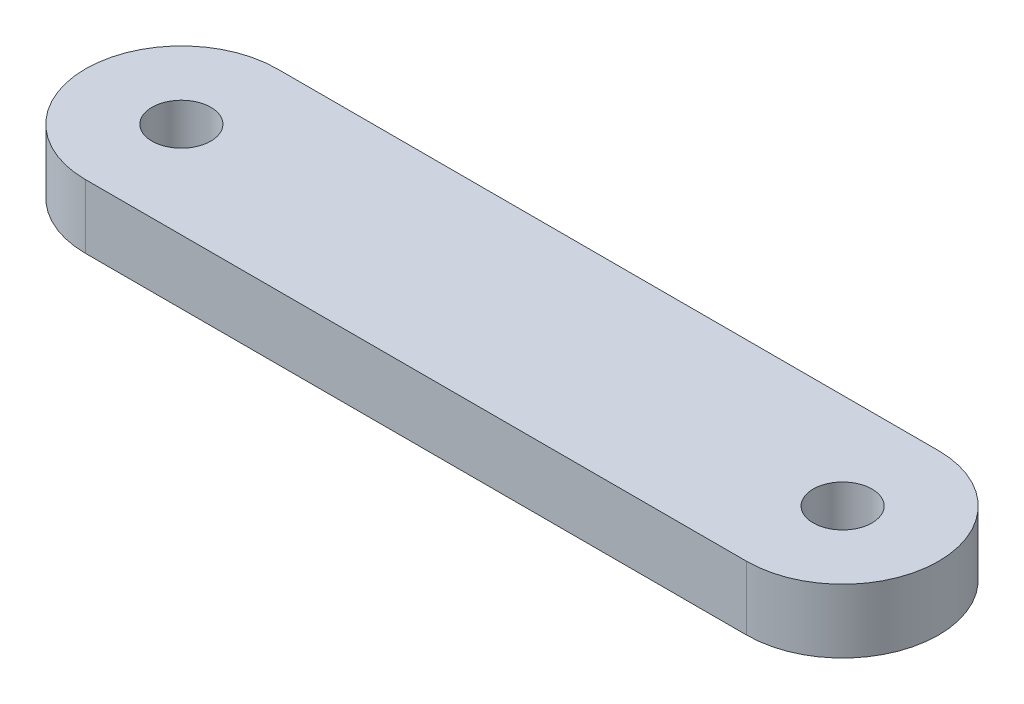
from build123d import *

# Parameters (mm, degrees)
SKETCH_1_R      = 2.3
EXTRUDE_1_DEPTH = 5


with BuildPart() as part:
    # 草图1 → 凸台-拉伸1 (new body)
    with BuildSketch(Plane(origin=(0, 0, 0), x_dir=(1, 0, 0), z_dir=(0, 1, 0))):
        with BuildLine():
            Line((-25.856722835, 7.5), (25.856722835, 7.5))
            ThreePointArc((25.856722835, 7.5), (33.356722835, 0), (25.856722835, -7.5))
            Line((25.856722835, -7.5), (-25.856722835, -7.5))
            ThreePointArc((-25.856722835, -7.5), (-33.356722835, 0), (-25.856722835, 7.5))
        make_face()
        with Locations(Location((-25.856722835, 0, 0), (0, 0, 270))):
            Circle(SKETCH_1_R, mode=Mode.SUBTRACT)
        with Locations(Location((25.856722835, 0, 0), (0, 0, 270))):
            Circle(SKETCH_1_R, mode=Mode.SUBTRACT)
    extrude(amount=EXTRUDE_1_DEPTH)


solid = part.part
